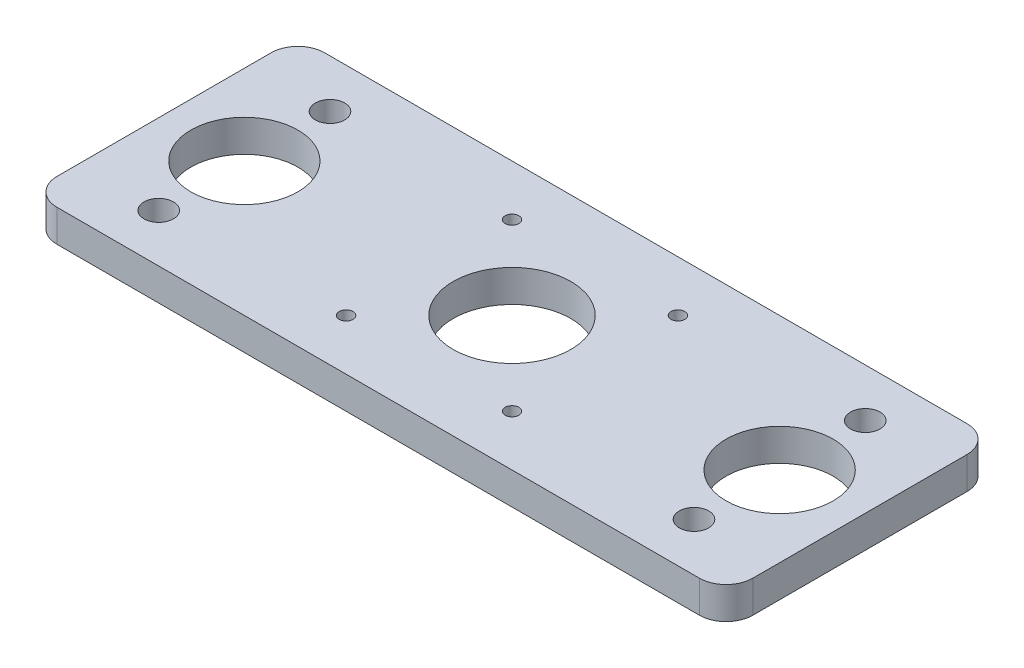
from build123d import *

# Parameters (mm, degrees)
SKETCH_1_R      = 2.75
SKETCH_1_R_2    = 11
SKETCH_1_R_3    = 1.283558174
SKETCH_1_R_4    = 10
EXTRUDE_1_DEPTH = 6


with BuildPart() as part:
    # 草图1 → 凸台-拉伸1 (new body)
    with BuildSketch(Plane(origin=(0, 0, 0), x_dir=(1, 0, 0), z_dir=(0, 1, 0))):
        with BuildLine():
            ThreePointArc((-65, 20), (-63.535533906, 23.535533906), (-60, 25))
            Line((-60, 25), (0, 25))
            Line((0, 25), (60, 25))
            ThreePointArc((60, 25), (63.535533906, 23.535533906), (65, 20))
            Line((65, 20), (65, -20))
            ThreePointArc((65, -20), (63.535533906, -23.535533906), (60, -25))
            Line((60, -25), (-60, -25))
            ThreePointArc((-60, -25), (-63.535533906, -23.535533906), (-65, -20))
            Line((-65, -20), (-65, 20))
        make_face()
        with Locations(Location((-50, 16, 0), (0, 0, 270))):
            Circle(SKETCH_1_R, mode=Mode.SUBTRACT)
        with Locations(Location((0, 0, 0), (0, 0, 270))):
            Circle(SKETCH_1_R_2, mode=Mode.SUBTRACT)
        with Locations(Location((15.5, 15.5, 0), (0, 0, 270))):
            Circle(SKETCH_1_R_3, mode=Mode.SUBTRACT)
        with Locations(Location((15.5, -15.5, 0), (0, 0, 270))):
            Circle(SKETCH_1_R_3, mode=Mode.SUBTRACT)
        with Locations(Location((-15.5, -15.5, 0), (0, 0, 270))):
            Circle(SKETCH_1_R_3, mode=Mode.SUBTRACT)
        with Locations(Location((-15.5, 15.5, 0), (0, 0, 270))):
            Circle(SKETCH_1_R_3, mode=Mode.SUBTRACT)
        with Locations(Location((50, 0, 0), (0, 0, 270))):
            Circle(SKETCH_1_R_4, mode=Mode.SUBTRACT)
        with Locations(Location((50, 16, 0), (0, 0, 270))):
            Circle(SKETCH_1_R, mode=Mode.SUBTRACT)
        with Locations(Location((50, -16, 0), (0, 0, 270))):
            Circle(SKETCH_1_R, mode=Mode.SUBTRACT)
        with Locations(Location((-50, -16, 0), (0, 0, 270))):
            Circle(SKETCH_1_R, mode=Mode.SUBTRACT)
        with Locations(Location((-50, 0, 0), (0, 0, 270))):
            Circle(SKETCH_1_R_4, mode=Mode.SUBTRACT)
    extrude(amount=EXTRUDE_1_DEPTH)


solid = part.part
